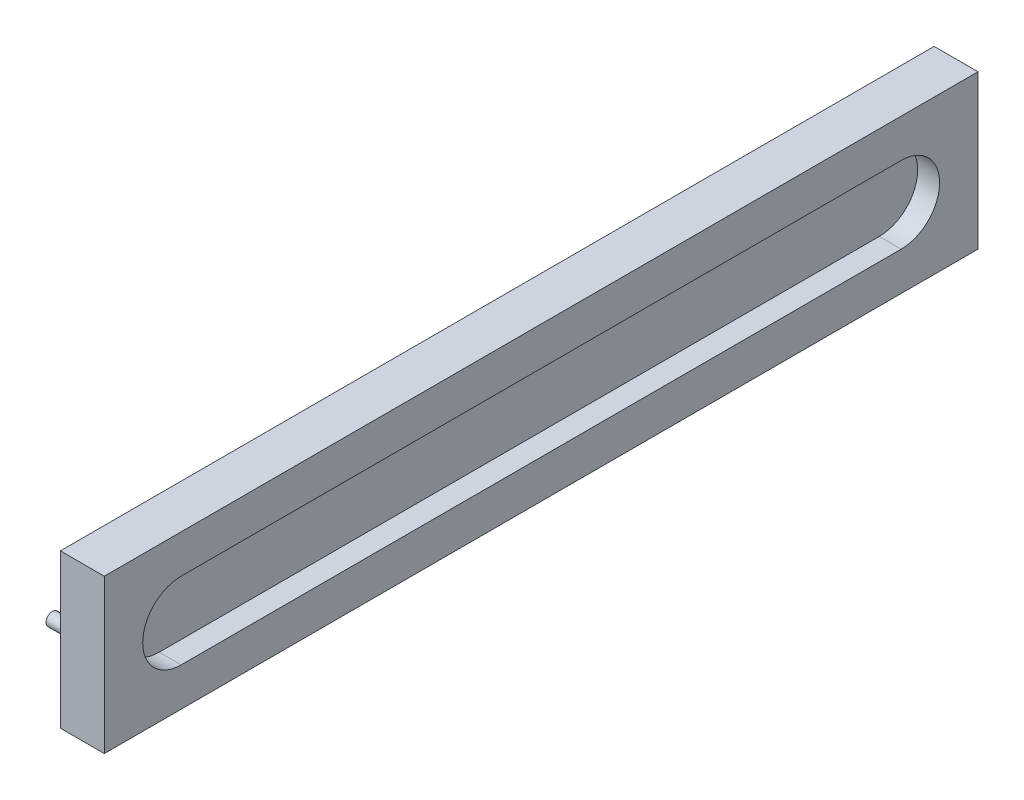
from build123d import *

# Parameters (mm, degrees)
SKETCH2_W           = 398.100558659
SKETCH2_H           = 70
BOSS_EXTRUDE1_DEPTH = 20
CUT_EXTRUDE1_DEPTH  = 10
SKETCH4_R           = 2.921
BOSS_EXTRUDE2_DEPTH = 10


with BuildPart() as part:
    # Sketch2 → Boss-Extrude1 (new body)
    with BuildSketch(Plane(origin=(0, 0, 0), x_dir=(0, 0, -1), z_dir=(1, 0, 0))):
        with Locations((199.05027933, 35)):
            Rectangle(SKETCH2_W, SKETCH2_H)
    extrude(amount=BOSS_EXTRUDE1_DEPTH)

    # Sketch3 → Cut-Extrude1 (cut)
    with BuildSketch(Plane(origin=(20, 0, 0), x_dir=(0, 0, -1), z_dir=(1, 0, 0))):
        with BuildLine():
            Line((35, 52.5), (363.100558659, 52.5))
            ThreePointArc((363.100558659, 52.5), (380.600558659, 35), (363.100558659, 17.5))
            Line((363.100558659, 17.5), (35, 17.5))
            ThreePointArc((35, 17.5), (17.5, 35), (35, 52.5))
        make_face()
    extrude(amount=-CUT_EXTRUDE1_DEPTH, mode=Mode.SUBTRACT)

    # Sketch4 → Boss-Extrude2 (add)
    with BuildSketch(Plane.ZY):
        with Locations((-391.750558659, 35)):
            Circle(SKETCH4_R)
        with Locations(Location((-6.35, 35, 0), (0, 0, 180))):
            Circle(SKETCH4_R)
    extrude(amount=BOSS_EXTRUDE2_DEPTH)


solid = part.part
